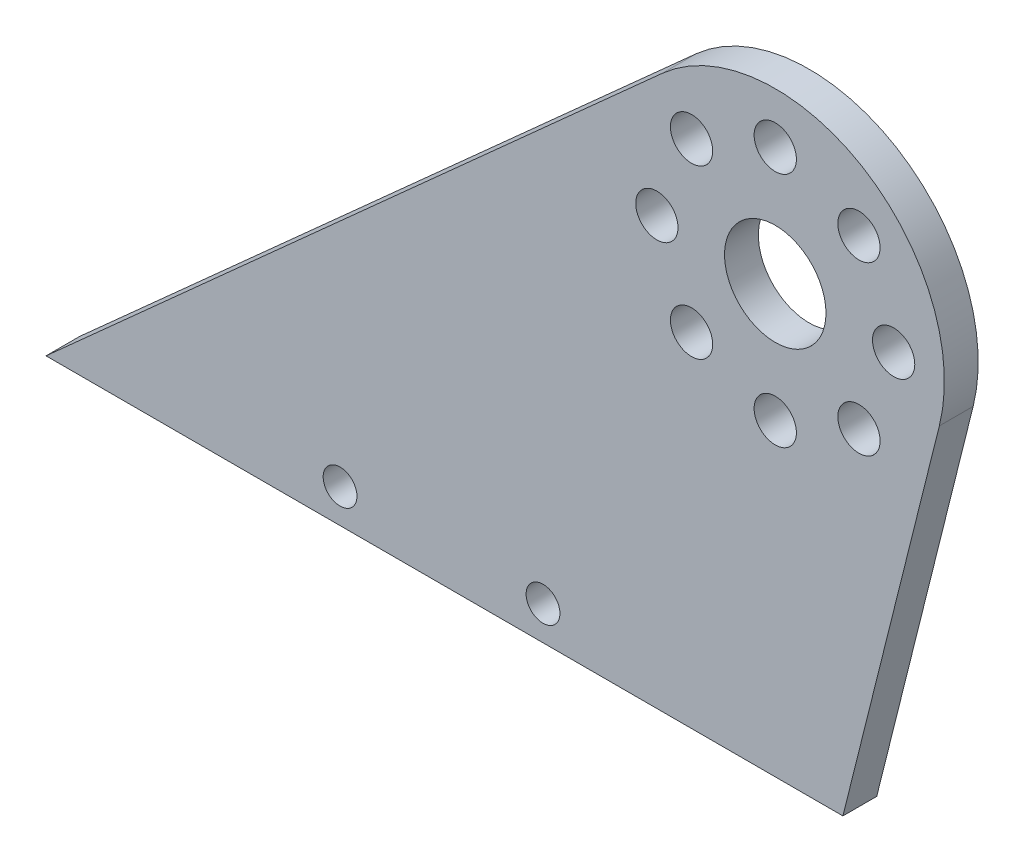
from build123d import *

# Parameters (mm, degrees)
SKETCH_1_R      = 3
SKETCH_1_R_2    = 1.25
SKETCH_1_R_3    = 1
EXTRUDE_1_DEPTH = 2


with BuildPart() as part:
    # 草圖1 → 填料-伸長1 (new body)
    with BuildSketch(Plane.XY):
        with BuildLine():
            Line((-41.078680873, -25.246867961), (3.125001345, -25.246867961))
            Line((3.125001345, -25.246867961), (4.000056753, -25.246867961))
            Line((4.000056753, -25.246867961), (9.701825934, -2.423751958))
            ThreePointArc((9.701825934, -2.423751958), (5.1603748, 8.56566004), (-6.677431122, 7.443917894))
            Line((-6.677431122, 7.443917894), (-43.120716176, -25.246867961))
            Line((-43.120716176, -25.246867961), (-41.078680873, -25.246867961))
        make_face()
        Circle(SKETCH_1_R, mode=Mode.SUBTRACT)
        with Locations((0, 7)):
            Circle(SKETCH_1_R_2, mode=Mode.SUBTRACT)
        with Locations((4.949747468, 4.949747468)):
            Circle(SKETCH_1_R_2, mode=Mode.SUBTRACT)
        with Locations((7, 0)):
            Circle(SKETCH_1_R_2, mode=Mode.SUBTRACT)
        with Locations((4.949747468, -4.949747468)):
            Circle(SKETCH_1_R_2, mode=Mode.SUBTRACT)
        with Locations((0, -7)):
            Circle(SKETCH_1_R_2, mode=Mode.SUBTRACT)
        with Locations((-4.949747468, -4.949747468)):
            Circle(SKETCH_1_R_2, mode=Mode.SUBTRACT)
        with Locations((-7, 0)):
            Circle(SKETCH_1_R_2, mode=Mode.SUBTRACT)
        with Locations((-4.949747468, 4.949747468)):
            Circle(SKETCH_1_R_2, mode=Mode.SUBTRACT)
        with Locations((-13.732609449, -23.246867961)):
            Circle(SKETCH_1_R_3, mode=Mode.SUBTRACT)
        with Locations((-25.732609449, -23.246867961)):
            Circle(SKETCH_1_R_3, mode=Mode.SUBTRACT)
    extrude(amount=EXTRUDE_1_DEPTH)


solid = part.part
